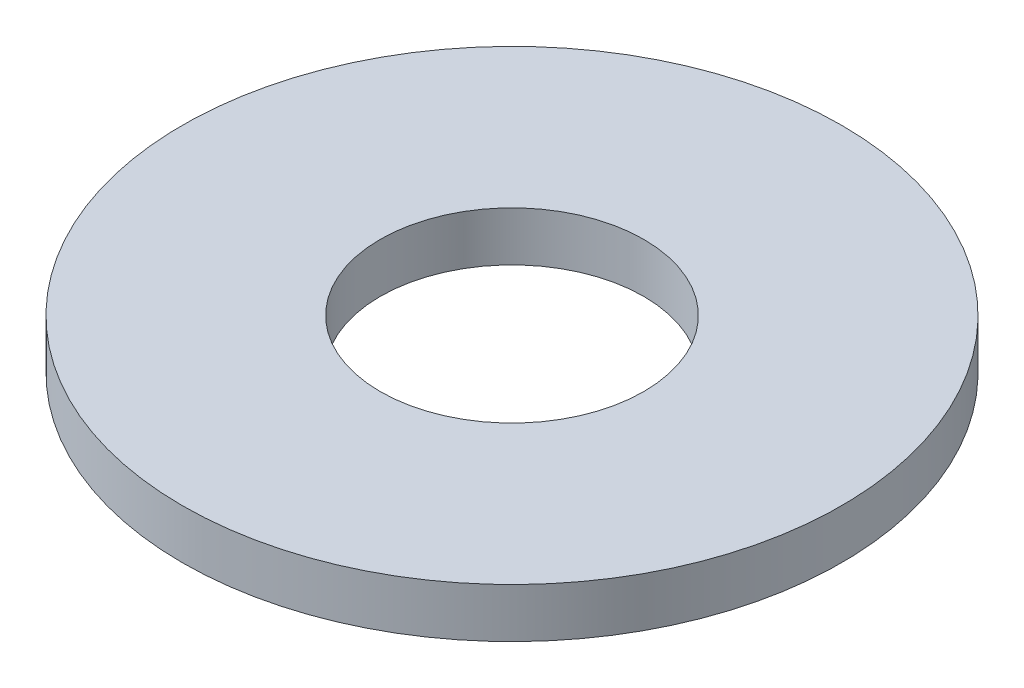
from build123d import *

# Parameters (mm, degrees)
SKETCH_1_W = 1.2
SKETCH_1_H = 0.3


with BuildPart() as part:
    # 草图1 → 旋转1 (revolve)
    with BuildSketch(Plane(origin=(0, 0, 0), x_dir=(0, 0, -1), z_dir=(1, 0, 0))):
        with Locations((1.4, 0)):
            Rectangle(SKETCH_1_W, SKETCH_1_H)
    revolve(axis=Axis((0, 0, 0), (0, 1, 0)))


solid = part.part
